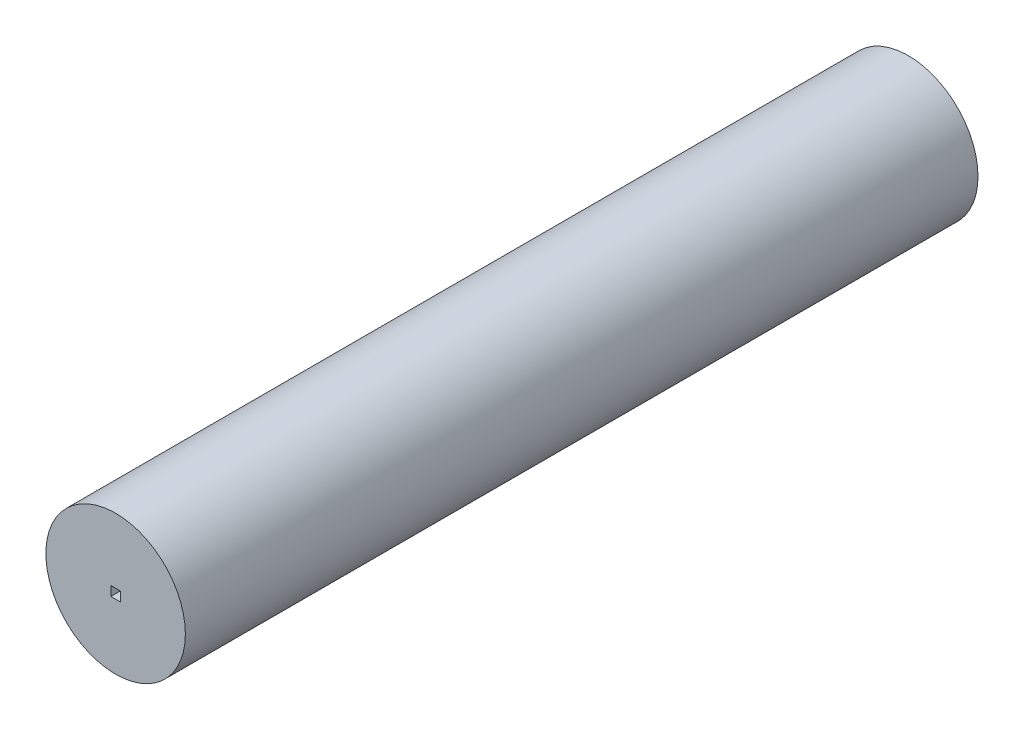
from build123d import *

# Parameters (mm, degrees)
ESQUISSE1_R             = 22
BOSS_EXTRU_1_DEPTH      = 250
ESQUISSE2_W             = 3
ESQUISSE2_H             = 3
ENL_V_MAT_EXTRU_1_DEPTH = 120


with BuildPart() as part:
    # Esquisse1 → Boss.-Extru.1 (new body)
    with BuildSketch(Plane.XY):
        Circle(ESQUISSE1_R)
    extrude(amount=BOSS_EXTRU_1_DEPTH)

    # Esquisse2 → Enlèv. mat.-Extru.1 (cut)
    with BuildSketch(Plane.XY.offset(250)):
        Rectangle(ESQUISSE2_W, ESQUISSE2_H)
    extrude(amount=-ENL_V_MAT_EXTRU_1_DEPTH, mode=Mode.SUBTRACT)


solid = part.part
